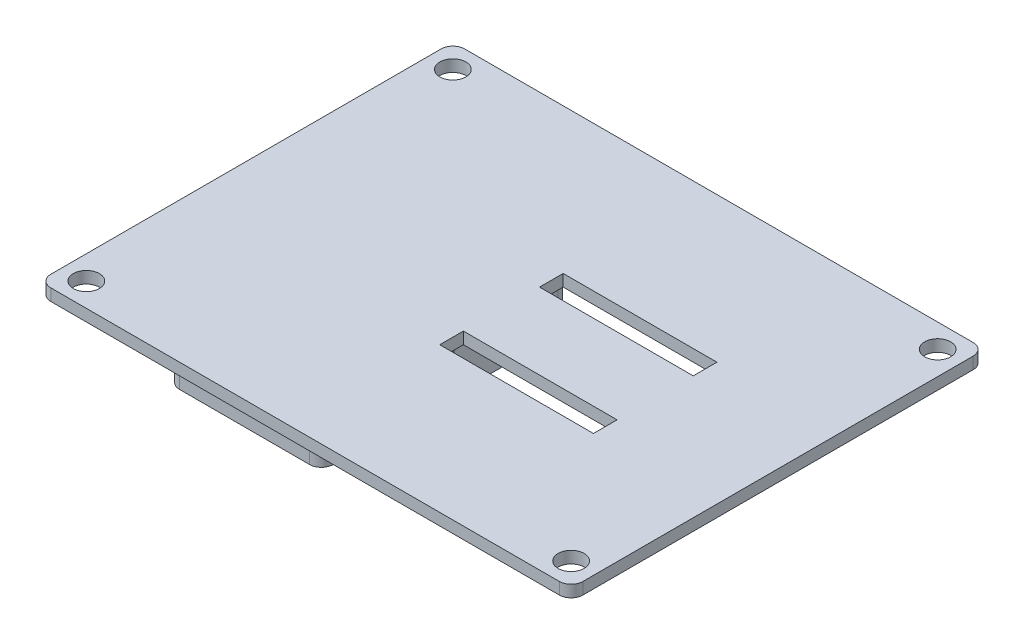
from build123d import *

# Parameters (mm, degrees)
SKETCH1_W                    = 114.3
SKETCH1_H                    = 88.9
BOSS_EXTRUDE2_DEPTH          = 2.54
SKETCH2_R                    = 2.794
CUT_EXTRUDE1_DEPTH           = 5.08
SKETCH9_W                    = 33.02
SKETCH9_H                    = 5.08
CUT_EXTRUDE5_DEPTH           = 6.35
SKETCH8_W                    = 33.02
SKETCH8_H                    = 53.34
BOSS_EXTRUDE4_DEPTH          = 21.59
SHELL4_T                     = -2.54
SKETCH13_W                   = 24.612851837
SKETCH13_H                   = 14.097856124
CUT_EXTRUDE6_DEPTH           = 5.08
FILLET5_R                    = 2.54
FILLET6_R                    = 2.54
FILLET7_R                    = 2.54
FILLET8_R                    = 2.54
FILLET1_R                    = 2.54
FILLET2_R                    = 2.54
FILLET3_R                    = 2.54
FILLET4_R                    = 2.54
FILLET9_R                    = 2.54
FILLET10_R                   = 2.54
FILLET11_R                   = 2.54
FILLET12_R                   = 2.54
SKETCH17_R                   = 3.175
BOSS_EXTRUDE5_DEPTH          = 7.62
SKETCH18_R                   = 1.651
CUT_EXTRUDE7_DEPTH           = 5.08
CUT_EXTRUDE7_DRAFT           = -2
CUT_EXTRUDE7_PROFILE_2_DEPTH = 5.08
CUT_EXTRUDE7_PROFILE_2_DRAFT = -2
CUT_EXTRUDE7_PROFILE_3_DEPTH = 5.08
CUT_EXTRUDE7_PROFILE_3_DRAFT = -2
CUT_EXTRUDE7_PROFILE_4_DEPTH = 5.08
CUT_EXTRUDE7_PROFILE_4_DRAFT = -2


with BuildPart() as part:
    # Sketch1 → Boss-Extrude2 (new body)
    with BuildSketch(Plane(origin=(0, 0, 0), x_dir=(1, 0, 0), z_dir=(0, 1, 0))):
        Rectangle(SKETCH1_W, SKETCH1_H)
    extrude(amount=BOSS_EXTRUDE2_DEPTH)

    # Sketch2 → Cut-Extrude1 (cut)
    with BuildSketch(Plane(origin=(0, 0, 0), x_dir=(-1, 0, 0), z_dir=(0, -1, 0))):
        with Locations(Location((52.07, 39.37, 0), (0, 0, 90))):
            Circle(SKETCH2_R)
        with Locations(Location((52.07, -39.37, 0), (0, 0, 90))):
            Circle(SKETCH2_R)
        with Locations(Location((-52.07, -39.37, 0), (0, 0, 90))):
            Circle(SKETCH2_R)
        with Locations(Location((-52.07, 39.37, 0), (0, 0, 90))):
            Circle(SKETCH2_R)
    extrude(amount=-CUT_EXTRUDE1_DEPTH, mode=Mode.SUBTRACT)

    # Sketch9 → Cut-Extrude5 (cut)
    with BuildSketch(Plane(origin=(0, 0, 0), x_dir=(-1, 0, 0), z_dir=(0, -1, 0))):
        with Locations((-14.245526461, -10.719909337)):
            Rectangle(SKETCH9_W, SKETCH9_H)
        with Locations((-14.245526461, 10.719909337)):
            Rectangle(SKETCH9_W, SKETCH9_H)
    extrude(amount=-CUT_EXTRUDE5_DEPTH, mode=Mode.SUBTRACT)

    # Fillet1
    fillet1_edges = [part.edges().sort_by_distance(p)[0] for p in [
        (57.15, 1.27, 44.45),
    ]]
    fillet(fillet1_edges, radius=FILLET1_R)

    # Fillet2
    fillet2_edges = [part.edges().sort_by_distance(p)[0] for p in [
        (-57.15, 1.27, -44.45),
    ]]
    fillet(fillet2_edges, radius=FILLET2_R)

    # Fillet3
    fillet3_edges = [part.edges().sort_by_distance(p)[0] for p in [
        (-57.15, 1.27, 44.45),
    ]]
    fillet(fillet3_edges, radius=FILLET3_R)

    # Fillet4
    fillet4_edges = [part.edges().sort_by_distance(p)[0] for p in [
        (57.15, 1.27, -44.45),
    ]]
    fillet(fillet4_edges, radius=FILLET4_R)

    # Sketch17 → Boss-Extrude5 (add)
    with BuildSketch(Plane(origin=(0, 0, 0), x_dir=(-1, 0, 0), z_dir=(0, -1, 0))):
        with Locations(Location((8.645141255, -8.255, 0), (0, 0, 90))):
            Circle(SKETCH17_R)
        with Locations(Location((8.645141255, 37.465, 0), (0, 0, 90))):
            Circle(SKETCH17_R)
        with Locations(Location((-37.074858745, 37.465, 0), (0, 0, 90))):
            Circle(SKETCH17_R)
        with Locations(Location((-37.074858745, -8.255, 0), (0, 0, 90))):
            Circle(SKETCH17_R)
    extrude(amount=BOSS_EXTRUDE5_DEPTH)


with BuildPart() as body_2:
    # Sketch8 → Boss-Extrude4 (new body)
    with BuildSketch(Plane(origin=(0, 0, 0), x_dir=(-1, 0, 0), z_dir=(0, -1, 0))):
        with Locations((32.055940653, 1.27)):
            Rectangle(SKETCH8_W, SKETCH8_H)
    extrude(amount=BOSS_EXTRUDE4_DEPTH)

    # Shell4
    shell4_openings = [body_2.faces().sort_by_distance(p)[0] for p in [
        (-32.055940653, -21.59, -1.27),
    ]]
    offset(amount=SHELL4_T, openings=shell4_openings, kind=Kind.INTERSECTION)

    # Sketch13 → Cut-Extrude6 (cut)
    with BuildSketch(Plane(origin=(0, 0, -27.94), x_dir=(-1, 0, 0), z_dir=(0, 0, -1))):
        with Locations((32.055940652, -10.795)):
            Rectangle(SKETCH13_W, SKETCH13_H)
    extrude(amount=-CUT_EXTRUDE6_DEPTH, mode=Mode.SUBTRACT)

    # Fillet5
    fillet5_edges = [body_2.edges().sort_by_distance(p)[0] for p in [
        (-19.749514734, -17.843928062, -26.67),
    ]]
    fillet(fillet5_edges, radius=FILLET5_R)

    # Fillet6
    fillet6_edges = [body_2.edges().sort_by_distance(p)[0] for p in [
        (-19.749514734, -3.746071938, -26.67),
    ]]
    fillet(fillet6_edges, radius=FILLET6_R)

    # Fillet7
    fillet7_edges = [body_2.edges().sort_by_distance(p)[0] for p in [
        (-44.362366571, -3.746071938, -26.67),
    ]]
    fillet(fillet7_edges, radius=FILLET7_R)

    # Fillet8
    fillet8_edges = [body_2.edges().sort_by_distance(p)[0] for p in [
        (-44.362366571, -17.843928062, -26.67),
    ]]
    fillet(fillet8_edges, radius=FILLET8_R)

    # Fillet9
    fillet9_edges = [body_2.edges().sort_by_distance(p)[0] for p in [
        (-15.545940653, -10.795, -27.94),
    ]]
    fillet(fillet9_edges, radius=FILLET9_R)

    # Fillet10
    fillet10_edges = [body_2.edges().sort_by_distance(p)[0] for p in [
        (-15.545940653, -10.795, 25.4),
    ]]
    fillet(fillet10_edges, radius=FILLET10_R)

    # Fillet11
    fillet11_edges = [body_2.edges().sort_by_distance(p)[0] for p in [
        (-48.565940653, -10.795, 25.4),
    ]]
    fillet(fillet11_edges, radius=FILLET11_R)

    # Fillet12
    fillet12_edges = [body_2.edges().sort_by_distance(p)[0] for p in [
        (-48.565940653, -10.795, -27.94),
    ]]
    fillet(fillet12_edges, radius=FILLET12_R)


with BuildPart() as cut_extrude7_tool:
    # Sketch18 → Cut-Extrude7 (with draft: the straight prism first)
    with BuildSketch(Plane.XZ.offset(7.62)):
        with Locations((37.074858745, 8.255)):
            Circle(SKETCH18_R)
    extrude(amount=-CUT_EXTRUDE7_DEPTH)
    # Cut-Extrude7: the draft: its side faces are tilted about the plane it starts from
    cut_extrude7_sides = [cut_extrude7_tool.faces().sort_by_distance(p)[0] for p in [
        (35.423858745, -5.08, 8.255),
    ]]
    draft(cut_extrude7_sides, Plane.XZ.offset(7.62), CUT_EXTRUDE7_DRAFT)


with BuildPart() as part_1:
    add(part.part)

    # Cut-Extrude7: cut by cut_extrude7_tool
    add(cut_extrude7_tool.part, mode=Mode.SUBTRACT)


with BuildPart() as cut_extrude7_profile_2_tool:
    # Sketch18 → Cut-Extrude7 profile 2 (with draft: the straight prism first)
    with BuildSketch(Plane.XZ.offset(7.62)):
        with Locations((37.074858745, -37.465)):
            Circle(SKETCH18_R)
    extrude(amount=-CUT_EXTRUDE7_PROFILE_2_DEPTH)
    # Cut-Extrude7 profile 2: the draft: its side faces are tilted about the plane it starts from
    cut_extrude7_profile_2_sides = [cut_extrude7_profile_2_tool.faces().sort_by_distance(p)[0] for p in [
        (35.423858745, -5.08, -37.465),
    ]]
    draft(cut_extrude7_profile_2_sides, Plane.XZ.offset(7.62), CUT_EXTRUDE7_PROFILE_2_DRAFT)


with BuildPart() as part_2:
    add(part_1.part)

    # Cut-Extrude7 profile 2: cut by cut_extrude7_profile_2_tool
    add(cut_extrude7_profile_2_tool.part, mode=Mode.SUBTRACT)


with BuildPart() as cut_extrude7_profile_3_tool:
    # Sketch18 → Cut-Extrude7 profile 3 (with draft: the straight prism first)
    with BuildSketch(Plane.XZ.offset(7.62)):
        with Locations((-8.645141255, -37.465)):
            Circle(SKETCH18_R)
    extrude(amount=-CUT_EXTRUDE7_PROFILE_3_DEPTH)
    # Cut-Extrude7 profile 3: the draft: its side faces are tilted about the plane it starts from
    cut_extrude7_profile_3_sides = [cut_extrude7_profile_3_tool.faces().sort_by_distance(p)[0] for p in [
        (-10.296141255, -5.08, -37.465),
    ]]
    draft(cut_extrude7_profile_3_sides, Plane.XZ.offset(7.62), CUT_EXTRUDE7_PROFILE_3_DRAFT)


with BuildPart() as part_3:
    add(part_2.part)

    # Cut-Extrude7 profile 3: cut by cut_extrude7_profile_3_tool
    add(cut_extrude7_profile_3_tool.part, mode=Mode.SUBTRACT)


with BuildPart() as cut_extrude7_profile_4_tool:
    # Sketch18 → Cut-Extrude7 profile 4 (with draft: the straight prism first)
    with BuildSketch(Plane.XZ.offset(7.62)):
        with Locations((-8.645141255, 8.255)):
            Circle(SKETCH18_R)
    extrude(amount=-CUT_EXTRUDE7_PROFILE_4_DEPTH)
    # Cut-Extrude7 profile 4: the draft: its side faces are tilted about the plane it starts from
    cut_extrude7_profile_4_sides = [cut_extrude7_profile_4_tool.faces().sort_by_distance(p)[0] for p in [
        (-10.296141255, -5.08, 8.255),
    ]]
    draft(cut_extrude7_profile_4_sides, Plane.XZ.offset(7.62), CUT_EXTRUDE7_PROFILE_4_DRAFT)


with BuildPart() as part_4:
    add(part_3.part)

    # Cut-Extrude7 profile 4: cut by cut_extrude7_profile_4_tool
    add(cut_extrude7_profile_4_tool.part, mode=Mode.SUBTRACT)


solid = Compound([body_2.part, part_4.part])
